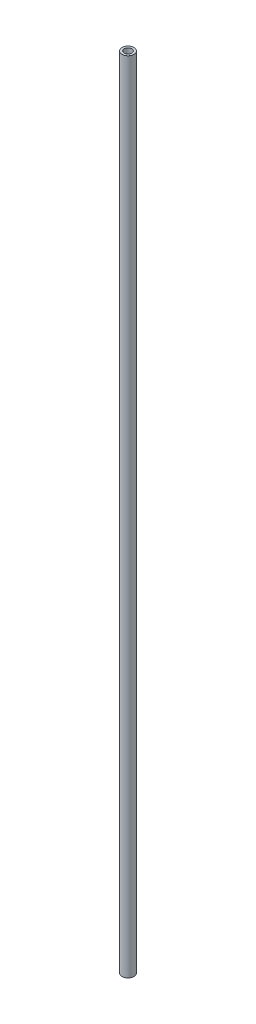
from build123d import *

# Parameters (mm, degrees)
SKETCH1_R           = 1
BOSS_EXTRUDE1_DEPTH = 133.2


with BuildPart() as part:
    # Sketch1 → Boss-Extrude1 (new body)
    with BuildSketch(Plane(origin=(0, 0, 0), x_dir=(1, 0, 0), z_dir=(0, 1, 0))):
        with Locations(Location((0, 0, 0), (0, 0, 270))):
            Circle(SKETCH1_R)
    extrude(amount=BOSS_EXTRUDE1_DEPTH)

    # Sketch4 → M1.6x0.35 Tapped Hole1 (revolve, cut)
    with BuildSketch(Plane(origin=(0, 133.2, 0), x_dir=(0, 0, 1), z_dir=(1, 0, 0))):
        Polygon((0, 0), (0, 6.375537887), (0.625, 6), (0.625, 0), align=None)
    m1_6x0_35_tapped_hole1 = revolve(axis=Axis((0, 139.55, 0), (0, -1, 0)), mode=Mode.SUBTRACT)

    # Mirror1: M1.6x0.35 Tapped Hole1 across plane
    add(m1_6x0_35_tapped_hole1.mirror(Plane(origin=(0, 66.6, 0), x_dir=(0, 0, 1), z_dir=(0, -1, 0))), mode=Mode.SUBTRACT)


solid = part.part
